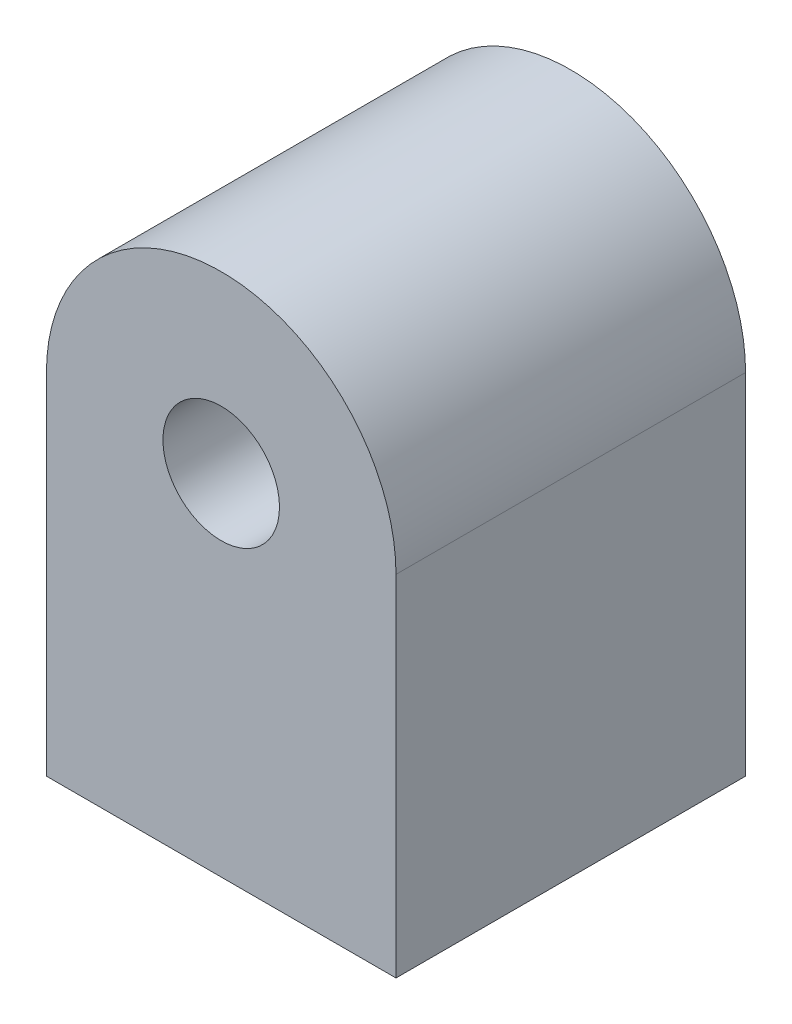
from build123d import *

# Parameters (mm, degrees)
SKETCH1_R           = 10
BOSS_EXTRUDE1_DEPTH = 60


with BuildPart() as part:
    # Sketch1 → Boss-Extrude1 (new body)
    with BuildSketch(Plane.XY):
        with BuildLine():
            Line((0, 0), (60, 0))
            Line((60, 0), (60, 60))
            ThreePointArc((60, 60), (30, 90), (0, 60))
            Line((0, 60), (0, 0))
        make_face()
        with Locations((30, 60)):
            Circle(SKETCH1_R, mode=Mode.SUBTRACT)
    extrude(amount=BOSS_EXTRUDE1_DEPTH)

    # Sketch4 → Cut-Revolve1 (revolve, cut)
    with BuildSketch(Plane.XY.offset(30)):
        with BuildLine():
            Line((30, 30), (30, -10))
            ThreePointArc((30, -10), (50, 10), (30, 30))
        make_face()
    revolve(axis=Axis((30, 30, 30), (0, -1, 0)), mode=Mode.SUBTRACT)


solid = part.part
